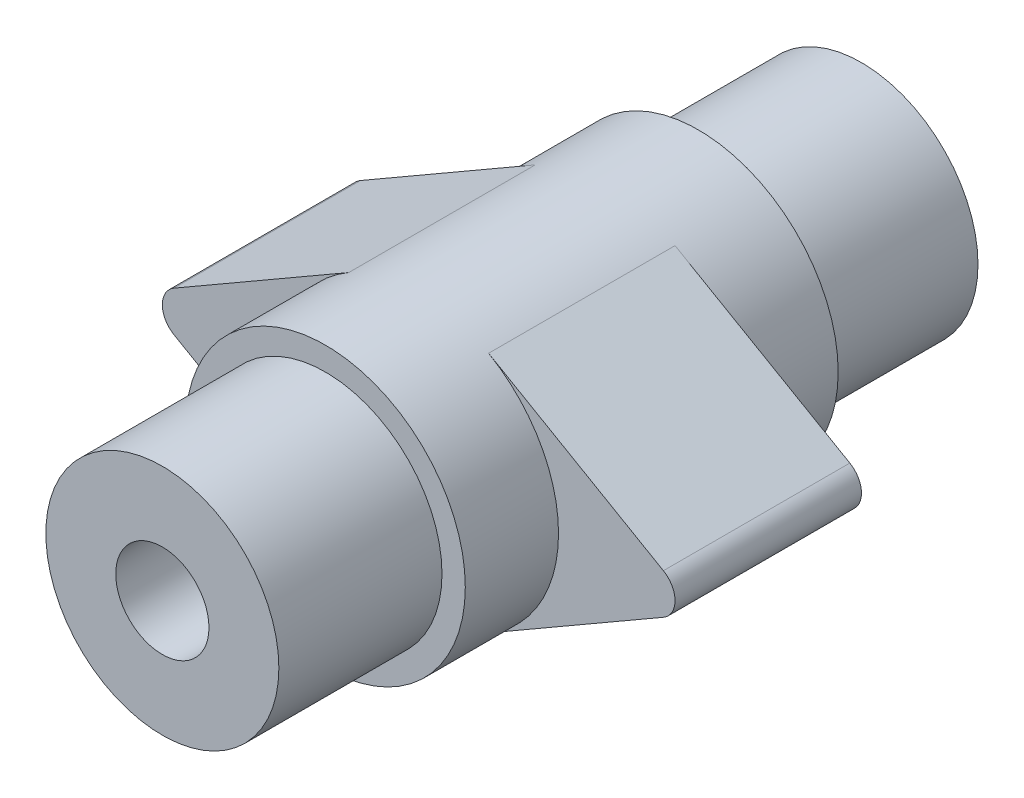
from build123d import *

# Parameters (mm, degrees)
SKETCH_1_R          = 6
EXTRUDE_1_DEPTH     = 16
EXTRUDE_START       = 4
EXTRUDE_6_DEPTH     = 8
SKETCH_9_R          = 5
EXTRUDE_7_DEPTH     = 7
EXTRUDE_START_2     = -23
SKETCH_9_2_R        = 5
EXTRUDE_8_DEPTH     = 7
SKETCH_11_R         = 2
CUT_EXTRUDE_1_DEPTH = 33.511536414


with BuildPart() as part:
    # 草图1 → 凸台-拉伸1 (new body)
    with BuildSketch(Plane.XY):
        Circle(SKETCH_1_R)
    extrude(amount=EXTRUDE_1_DEPTH)

    # 草图8 → 凸台-拉伸6 (add)
    with BuildSketch(Plane.XY.offset(EXTRUDE_START)):
        with BuildLine():
            Line((10.5, 0.866025404), (3, 5.196152423))
            ThreePointArc((3, 5.196152423), (6, 0), (3, -5.196152423))
            Line((3, -5.196152423), (10.5, -0.866025404))
            ThreePointArc((10.5, -0.866025404), (11, 0), (10.5, 0.866025404))
        make_face()
        with BuildLine():
            Line((-10.5, -0.866025404), (-3, -5.196152423))
            ThreePointArc((-3, -5.196152423), (-6, 0), (-3, 5.196152423))
            Line((-3, 5.196152423), (-10.5, 0.866025404))
            ThreePointArc((-10.5, 0.866025404), (-11, 0), (-10.5, -0.866025404))
        make_face()
    extrude(amount=EXTRUDE_6_DEPTH)

    # 草图9 → 凸台-拉伸7 (add)
    with BuildSketch(Plane.XY.offset(16)):
        Circle(SKETCH_9_R)
    extrude(amount=EXTRUDE_7_DEPTH)

    # 草图9<2> → 凸台-拉伸8 (add)
    with BuildSketch(Plane.XY.offset(16).offset(EXTRUDE_START_2)):
        Circle(SKETCH_9_2_R)
    extrude(amount=EXTRUDE_8_DEPTH)

    # 草图11 → 切除-拉伸1 (cut, through all)
    with BuildSketch(Plane.XY.offset(23)):
        Circle(SKETCH_11_R)
    extrude(amount=-CUT_EXTRUDE_1_DEPTH, mode=Mode.SUBTRACT)


solid = part.part
